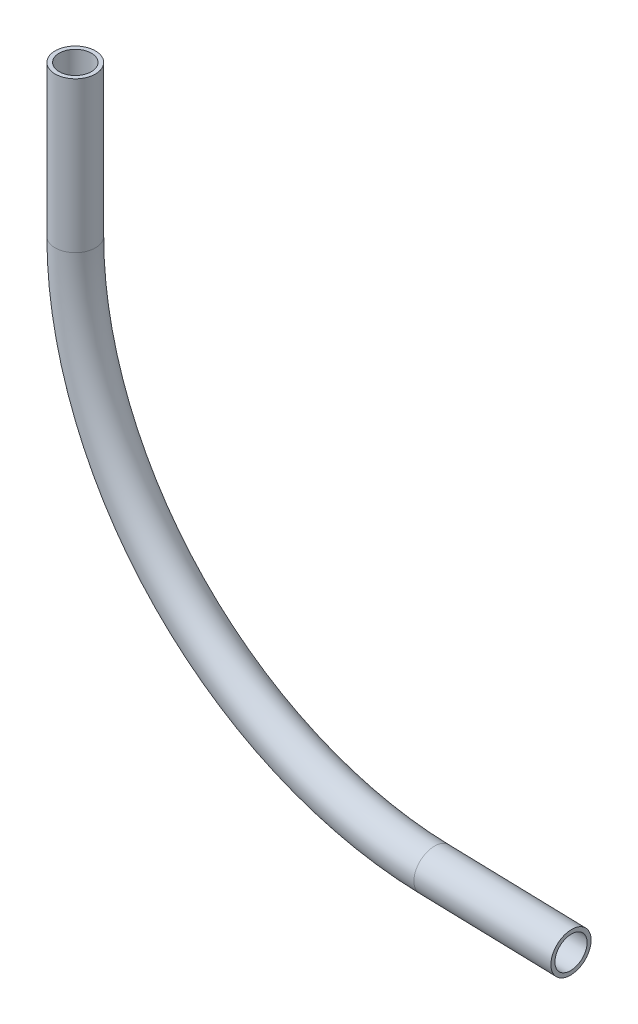
from build123d import *

# Parameters (mm, degrees)
SKETCH4_R           = 3.81
SKETCH4_R_2         = 3.048
BOSS_EXTRUDE1_DEPTH = 2.54
SKETCH4_3_R         = 3.81
SKETCH4_3_R_2       = 3.048


with BuildPart() as part:
    # Sketch4 → Boss-Extrude1 (new body)
    with BuildSketch(Plane(origin=(0, 110.370938621, 0), x_dir=(-1, 0, 0), z_dir=(0, 1, 0))):
        with Locations(Location((0, 0, 0), (0, 0, 90))):
            Circle(SKETCH4_R)
        with Locations(Location((0, 0, 0), (0, 0, 90))):
            Circle(SKETCH4_R_2, mode=Mode.SUBTRACT)
    extrude(amount=-BOSS_EXTRUDE1_DEPTH)

    # Sweep2: sweep along a path in Sketch3
    with BuildLine(Plane.XY) as sweep2_path:
        Line((0, 110.370938621), (0, 81.839949684))
        ThreePointArc((0, 81.839949684), (19.796310895, 33.11982338), (67.964229263, 12.015409809))
        Line((67.964229263, 12.015409809), (93.926499612, 11.314239564))
    # Sketch4<3> → Sweep2 (sweep)
    with BuildSketch(Plane(origin=(0, 110.370938621, 0), x_dir=(-1, 0, 0), z_dir=(0, 1, 0))):
        Circle(SKETCH4_3_R)
        Circle(SKETCH4_3_R_2, mode=Mode.SUBTRACT)
    sweep(path=sweep2_path.line)


solid = part.part
